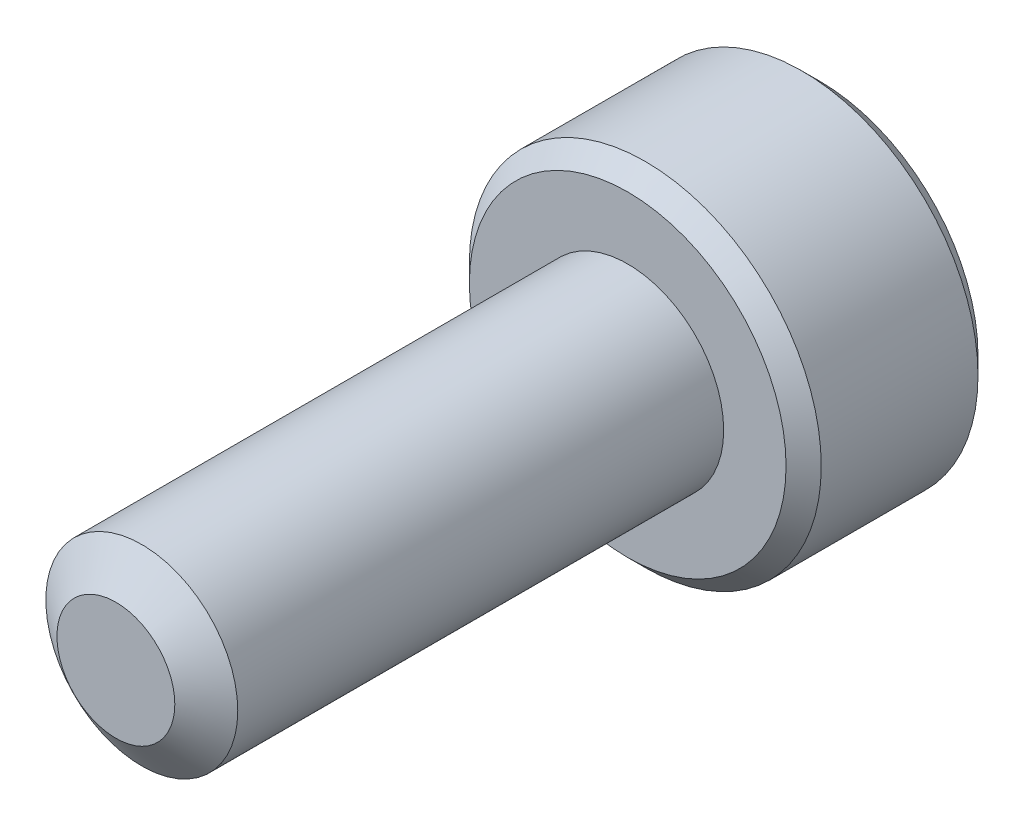
from build123d import *

# Parameters (mm, degrees)
SKETCH1_R          = 1.5
EXTRUDE1_DEPTH     = 8
SKETCH6_R          = 2.75
EXTRUDE2_DEPTH     = 3
CUT_EXTRUDE1_DEPTH = 1.875
CHAMFER1_SIZE      = 0.275


with BuildPart() as part:
    # Sketch1 → Extrude1 (new body)
    with BuildSketch(Plane.XY):
        Circle(SKETCH1_R)
    extrude(amount=-EXTRUDE1_DEPTH)

    # Sketch4 → Cut-Revolve1 (revolve, cut)
    with BuildSketch(Plane(origin=(0, 0, 0), x_dir=(0, 0, -1), z_dir=(1, 0, 0))):
        Polygon((0.405251783, 1.5), (0, 0.921240474), (0, 1.5), align=None)
    revolve(axis=Axis((0, 0, 0), (0, 0, -1)), mode=Mode.SUBTRACT)

    # Sketch6 → Extrude2 (add)
    with BuildSketch(Plane(origin=(0, 0, -8), x_dir=(-1, 0, 0), z_dir=(0, 0, -1))):
        Circle(SKETCH6_R)
    extrude(amount=EXTRUDE2_DEPTH)

    # Sketch7 → Cut-Extrude1 (cut)
    with BuildSketch(Plane(origin=(0, 0, -11), x_dir=(-1, 0, 0), z_dir=(0, 0, -1))):
        Polygon((0, 1.443375673), (-1.25, 0.721687836), (-1.25, -0.721687836), (0, -1.443375673), (1.25, -0.721687836), (1.25, 0.721687836), align=None)
    extrude(amount=-CUT_EXTRUDE1_DEPTH, mode=Mode.SUBTRACT)

    # Chamfer1
    chamfer1_edges = [part.edges().sort_by_distance(p)[0] for p in [
        (2.75, 0, -11),
        (2.75, 0, -8),
    ]]
    chamfer(chamfer1_edges, length=CHAMFER1_SIZE)


solid = part.part
